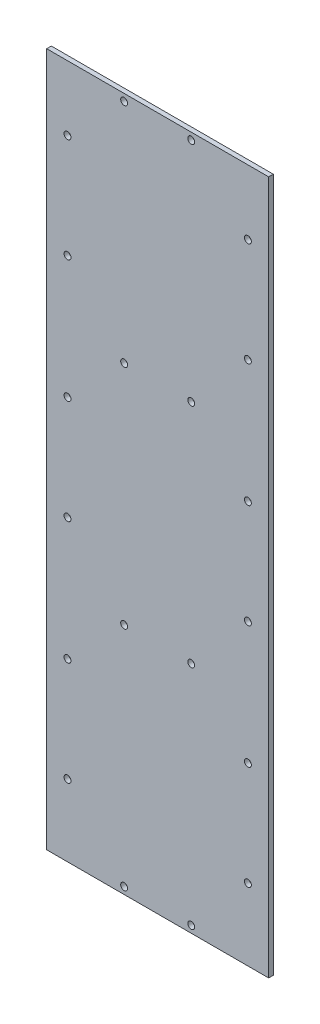
from build123d import *

# Parameters (mm, degrees)
SKETCH1_W           = 96
SKETCH1_H           = 300
BOSS_EXTRUDE1_DEPTH = 2
SKETCH2_R           = 1.5
CUT_EXTRUDE1_DEPTH  = 10


with BuildPart() as part:
    # Sketch1 → Boss-Extrude1 (new body)
    with BuildSketch(Plane.XY):
        Rectangle(SKETCH1_W, SKETCH1_H)
    extrude(amount=BOSS_EXTRUDE1_DEPTH)

    # Sketch2 → Cut-Extrude1 (cut)
    with BuildSketch(Plane.XY.offset(2)):
        with Locations((-39, 122)):
            Circle(SKETCH2_R)
        with Locations((-39, 77)):
            Circle(SKETCH2_R)
        with Locations((39, 122)):
            Circle(SKETCH2_R)
        with Locations((39, 77)):
            Circle(SKETCH2_R)
        with Locations((-39, 24)):
            Circle(SKETCH2_R)
        with Locations((-39, -21)):
            Circle(SKETCH2_R)
        with Locations((39, 24)):
            Circle(SKETCH2_R)
        with Locations((39, -21)):
            Circle(SKETCH2_R)
        with Locations((-39, -74)):
            Circle(SKETCH2_R)
        with Locations((-39, -119)):
            Circle(SKETCH2_R)
        with Locations((39, -74)):
            Circle(SKETCH2_R)
        with Locations((39, -119)):
            Circle(SKETCH2_R)
        with Locations((14.5, -147)):
            Circle(SKETCH2_R)
        with Locations((-14.5, -147)):
            Circle(SKETCH2_R)
        with Locations((-14.5, -49)):
            Circle(SKETCH2_R)
        with Locations((14.5, -49)):
            Circle(SKETCH2_R)
        with Locations((-14.5, 49)):
            Circle(SKETCH2_R)
        with Locations((14.5, 49)):
            Circle(SKETCH2_R)
        with Locations((-14.5, 147)):
            Circle(SKETCH2_R)
        with Locations((14.5, 147)):
            Circle(SKETCH2_R)
    extrude(amount=-CUT_EXTRUDE1_DEPTH, mode=Mode.SUBTRACT)


solid = part.part
